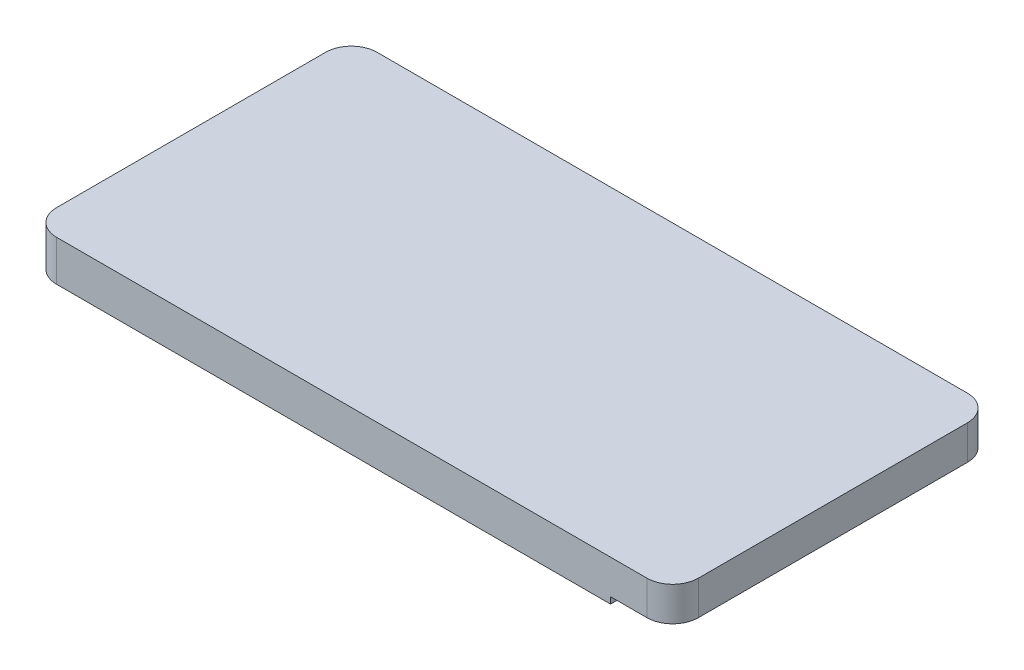
from build123d import *

# Parameters (mm, degrees)
EXTRUDE_1_DEPTH     = 9.5
SKETCH_2_5_W        = 4.5
SKETCH_2_5_H        = 14
SKETCH_2_5_H_2      = 4.5
EXTRUDE_5_DEPTH     = 1.5
SKETCH_2_6_R        = 1.25
EXTRUDE_6_DEPTH     = 1
SKETCH_2_7_R        = 1.65
CUT_EXTRUDE_1_DEPTH = 4
SKETCH_3_W          = 14.5
SKETCH_3_H          = 74.8
CUT_EXTRUDE_2_DEPTH = 1.5
SKETCH_2_R          = 3.6
SKETCH_2_W          = 3.5
SKETCH_2_H          = 5.5
EXTRUDE_7_DEPTH     = 5


with BuildPart() as part:
    # 草图1 → 凸台-拉伸1 (new body)
    with BuildSketch(Plane(origin=(0, 0, 0), x_dir=(1, 0, 0), z_dir=(0, 1, 0))):
        with BuildLine():
            Line((6, 0), (143.8, 0))
            ThreePointArc((143.8, 0), (148.042640687, -1.757359313), (149.8, -6))
            Line((149.8, -6), (149.8, -68.8))
            ThreePointArc((149.8, -68.8), (148.042640687, -73.042640687), (143.8, -74.8))
            Line((143.8, -74.8), (6, -74.8))
            ThreePointArc((6, -74.8), (1.757359313, -73.042640687), (0, -68.8))
            Line((0, -68.8), (0, -6))
            ThreePointArc((0, -6), (1.757359313, -1.757359313), (6, 0))
        make_face()
    extrude(amount=EXTRUDE_1_DEPTH)

    # 草图2<5> → 凸台-拉伸5 (add)
    with BuildSketch(Plane(origin=(0, 0, 0), x_dir=(-1, 0, 0), z_dir=(0, -1, 0))):
        with Locations((-40.85, -52.05)):
            Rectangle(SKETCH_2_5_W, SKETCH_2_5_H)
        with Locations((-43.05, -63.8)):
            Rectangle(SKETCH_2_5_W, SKETCH_2_5_H_2)
    extrude(amount=EXTRUDE_5_DEPTH)

    # 草图2<6> → 凸台-拉伸6 (add)
    with BuildSketch(Plane(origin=(0, 0, 0), x_dir=(-1, 0, 0), z_dir=(0, -1, 0))):
        with Locations((-130.8, -5.6)):
            Circle(SKETCH_2_6_R)
        with Locations((-131.1, -55.65)):
            Circle(SKETCH_2_6_R)
        with Locations((-47.7, -4.85)):
            Circle(SKETCH_2_6_R)
        with Locations((-48.1, -68.75)):
            Circle(SKETCH_2_6_R)
        with Locations((-22.8, -70.3)):
            Circle(SKETCH_2_6_R)
        with Locations((-5.05, -71.05)):
            Circle(SKETCH_2_6_R)
        with Locations((-5.05, -3.25)):
            Circle(SKETCH_2_6_R)
    extrude(amount=EXTRUDE_6_DEPTH)

    # 草图2<7> → 切除-拉伸1 (cut)
    with BuildSketch(Plane(origin=(0, 0, 0), x_dir=(-1, 0, 0), z_dir=(0, -1, 0))):
        with Locations((-103.2, -9.35)):
            Circle(SKETCH_2_7_R)
        with Locations((-103.2, -64.25)):
            Circle(SKETCH_2_7_R)
        with Locations((-59.2, -64.25)):
            Circle(SKETCH_2_7_R)
        with Locations((-59.2, -9.35)):
            Circle(SKETCH_2_7_R)
    extrude(amount=-CUT_EXTRUDE_1_DEPTH, mode=Mode.SUBTRACT)

    # 草图3 → 切除-拉伸2 (cut)
    with BuildSketch(Plane(origin=(0, 0, 0), x_dir=(1, 0, 0), z_dir=(0, 1, 0))):
        with Locations((142.55, -37.4)):
            Rectangle(SKETCH_3_W, SKETCH_3_H)
    extrude(amount=CUT_EXTRUDE_2_DEPTH, mode=Mode.SUBTRACT)

    # 草图2 → 凸台-拉伸7 (add)
    with BuildSketch(Plane(origin=(0, 0, 0), x_dir=(-1, 0, 0), z_dir=(0, -1, 0))):
        with Locations((-19, -37.4)):
            Circle(SKETCH_2_R)
        with Locations((-29.05, -37.4)):
            Rectangle(SKETCH_2_W, SKETCH_2_H)
    extrude(amount=EXTRUDE_7_DEPTH)


solid = part.part
